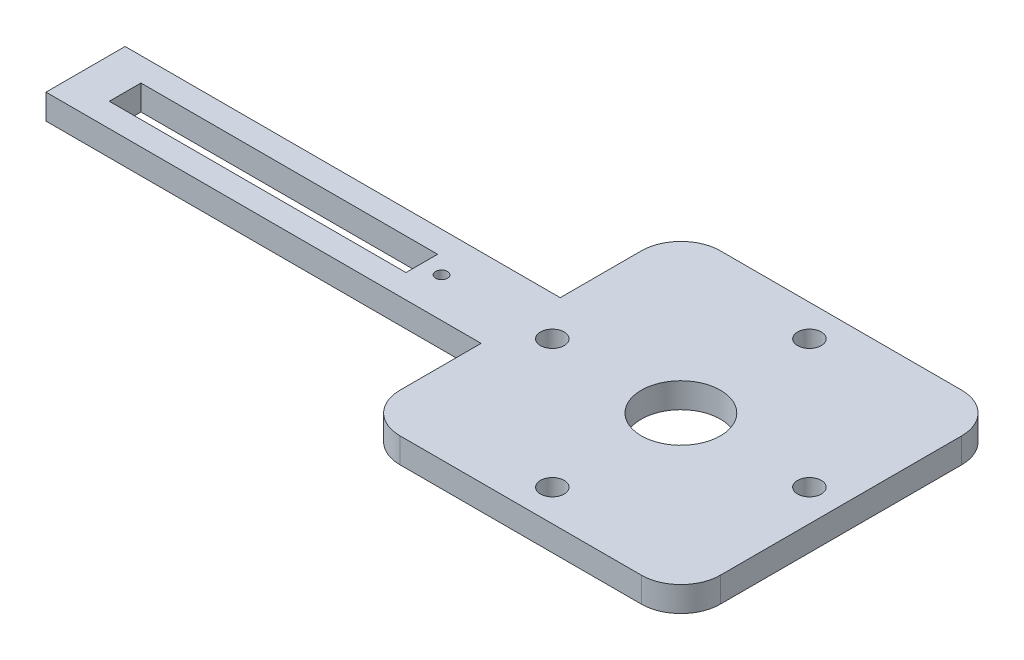
from build123d import *

# Parameters (mm, degrees)
SKETCH1_R           = 10
SKETCH1_R_2         = 3
SKETCH1_R_3         = 1.5
SKETCH1_W           = 75
SKETCH1_H           = 8
BOSS_EXTRUDE1_DEPTH = 6.35
FILLET1_R           = 10


with BuildPart() as part:
    # Sketch1 → Boss-Extrude1 (new body)
    with BuildSketch(Plane(origin=(0, 0, 0), x_dir=(1, 0, 0), z_dir=(0, 1, 0))):
        Polygon((-40.5, 40.5), (40.5, 40.5), (40.5, -40.5), (-40.5, -40.5), (-40.5, -10), (-140.5, -10), (-150.5, -10), (-150.5, 10), (-140.5, 10), (-40.5, 10), align=None)
        with Locations(Location((0, 0, 0), (0, 0, 270))):
            Circle(SKETCH1_R, mode=Mode.SUBTRACT)
        with Locations(Location((0, 32.5, 0), (0, 0, 270))):
            Circle(SKETCH1_R_2, mode=Mode.SUBTRACT)
        with Locations(Location((-32.5, 0, 0), (0, 0, 270))):
            Circle(SKETCH1_R_2, mode=Mode.SUBTRACT)
        with Locations(Location((0, -32.5, 0), (0, 0, 270))):
            Circle(SKETCH1_R_2, mode=Mode.SUBTRACT)
        with Locations(Location((32.5, 0, 0), (0, 0, 270))):
            Circle(SKETCH1_R_2, mode=Mode.SUBTRACT)
        with Locations(Location((-60.5, 0, 0), (0, 0, 270))):
            Circle(SKETCH1_R_3, mode=Mode.SUBTRACT)
        with Locations((-103, 0)):
            Rectangle(SKETCH1_W, SKETCH1_H, mode=Mode.SUBTRACT)
    extrude(amount=BOSS_EXTRUDE1_DEPTH)

    # Fillet1
    fillet1_edges = [part.edges().sort_by_distance(p)[0] for p in [
        (40.5, 3.175, 40.5),
        (-40.5, 3.175, 40.5),
        (-40.5, 3.175, -40.5),
        (40.5, 3.175, -40.5),
    ]]
    fillet(fillet1_edges, radius=FILLET1_R)


solid = part.part
